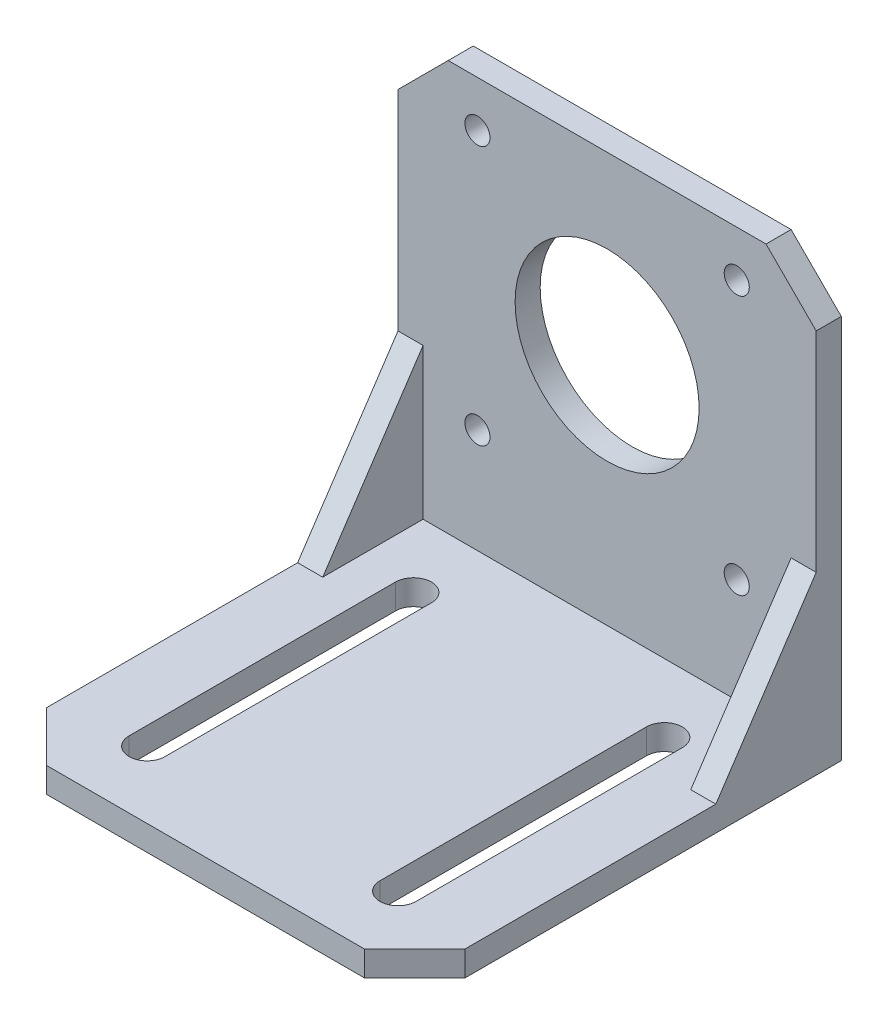
from build123d import *

# Parameters (mm, degrees)
SKETCH1_R           = 11
SKETCH1_R_2         = 1.5
BOSS_EXTRUDE1_DEPTH = 3
SKETCH2_W           = 50
SKETCH2_H           = 3
BOSS_EXTRUDE2_DEPTH = 48
CUT_EXTRUDE1_REACH  = 79.006
BOSS_EXTRUDE3_START = 22
BOSS_EXTRUDE3_DEPTH = 3
LPATTERN2_COUNT     = 2
LPATTERN2_PITCH     = 47
CUT_EXTRUDE2_REACH  = 66.707
CUT_EXTRUDE3_REACH  = 79.006


with BuildPart() as part:
    # Sketch1 → Boss-Extrude1 (new body)
    with BuildSketch(Plane.XY):
        Polygon((-25, 21), (25, 21), (25, -21), (25, -31), (-25, -31), (-25, -21), align=None)
        Circle(SKETCH1_R, mode=Mode.SUBTRACT)
        with Locations((-15.5, 15.5)):
            Circle(SKETCH1_R_2, mode=Mode.SUBTRACT)
        with Locations((15.5, 15.5)):
            Circle(SKETCH1_R_2, mode=Mode.SUBTRACT)
        with Locations((-15.5, -15.5)):
            Circle(SKETCH1_R_2, mode=Mode.SUBTRACT)
        with Locations((15.5, -15.5)):
            Circle(SKETCH1_R_2, mode=Mode.SUBTRACT)
    extrude(amount=BOSS_EXTRUDE1_DEPTH)

    # Sketch2 → Boss-Extrude2 (add)
    with BuildSketch(Plane.XY.offset(3)):
        with Locations((0, -29.5)):
            Rectangle(SKETCH2_W, SKETCH2_H)
    extrude(amount=BOSS_EXTRUDE2_DEPTH)

    # Sketch3 → Cut-Extrude1 (cut, up to next)
    with BuildSketch(Plane.XZ.offset(31), mode=Mode.PRIVATE) as cut_extrude1_sk1:
        with BuildLine():
            Line((-12.85, 43), (-12.85, 11.15))
            ThreePointArc((-12.85, 11.15), (-15, 9), (-17.15, 11.15))
            Line((-17.15, 11.15), (-17.15, 43))
            ThreePointArc((-17.15, 43), (-15, 45.15), (-12.85, 43))
        make_face()
    cut_extrude1_tool1 = extrude(cut_extrude1_sk1.sketch, amount=-CUT_EXTRUDE1_REACH, mode=Mode.PRIVATE) & part.part
    # Sketch3 → Cut-Extrude1 (cut, up to next)
    with BuildSketch(Plane.XZ.offset(31), mode=Mode.PRIVATE) as cut_extrude1_sk2:
        with BuildLine():
            Line((12.85, 43), (12.85, 11.15))
            ThreePointArc((12.85, 11.15), (15, 9), (17.15, 11.15))
            Line((17.15, 11.15), (17.15, 43))
            ThreePointArc((17.15, 43), (15, 45.15), (12.85, 43))
        make_face()
    cut_extrude1_tool2 = extrude(cut_extrude1_sk2.sketch, amount=-CUT_EXTRUDE1_REACH, mode=Mode.PRIVATE) & part.part
    add(cut_extrude1_tool1.solids().sort_by_distance((-15, -31, 27.075))[0], mode=Mode.SUBTRACT)
    add(cut_extrude1_tool2.solids().sort_by_distance((15, -31, 27.075))[0], mode=Mode.SUBTRACT)

    # Sketch4 → Boss-Extrude3 (add)
    with BuildSketch(Plane(origin=(0, 0, 0), x_dir=(0, 0, -1), z_dir=(1, 0, 0)).offset(BOSS_EXTRUDE3_START)):
        Polygon((-3, -28), (-3, -10), (-15, -28), align=None)
    boss_extrude3 = extrude(amount=BOSS_EXTRUDE3_DEPTH)

    # LPattern2: Boss-Extrude3 ×2
    with Locations(*[(-i * LPATTERN2_PITCH, 0, 0) for i in range(1, LPATTERN2_COUNT)]):
        add(boss_extrude3)

    # Sketch5 → Cut-Extrude2 (cut, up to next)
    with BuildSketch(Plane(origin=(0, 0, 0), x_dir=(-1, 0, 0), z_dir=(0, 0, -1)), mode=Mode.PRIVATE) as cut_extrude2_sk1:
        Polygon((-19, 21), (-25, 15), (-25, 21), align=None)
    cut_extrude2_tool1 = extrude(cut_extrude2_sk1.sketch, amount=-CUT_EXTRUDE2_REACH, mode=Mode.PRIVATE) & part.part
    # Sketch5 → Cut-Extrude2 (cut, up to next)
    with BuildSketch(Plane(origin=(0, 0, 0), x_dir=(-1, 0, 0), z_dir=(0, 0, -1)), mode=Mode.PRIVATE) as cut_extrude2_sk2:
        Polygon((25, 21), (19, 21), (25, 15), align=None)
    cut_extrude2_tool2 = extrude(cut_extrude2_sk2.sketch, amount=-CUT_EXTRUDE2_REACH, mode=Mode.PRIVATE) & part.part
    add(cut_extrude2_tool1.solids().sort_by_distance((23, 19, 0))[0], mode=Mode.SUBTRACT)
    add(cut_extrude2_tool2.solids().sort_by_distance((-23, 19, 0))[0], mode=Mode.SUBTRACT)

    # Sketch6 → Cut-Extrude3 (cut, up to next)
    with BuildSketch(Plane.XZ.offset(31), mode=Mode.PRIVATE) as cut_extrude3_sk1:
        Polygon((-25, 51), (-25, 45), (-19, 51), align=None)
    cut_extrude3_tool1 = extrude(cut_extrude3_sk1.sketch, amount=-CUT_EXTRUDE3_REACH, mode=Mode.PRIVATE) & part.part
    # Sketch6 → Cut-Extrude3 (cut, up to next)
    with BuildSketch(Plane.XZ.offset(31), mode=Mode.PRIVATE) as cut_extrude3_sk2:
        Polygon((25, 51), (19, 51), (25, 45), align=None)
    cut_extrude3_tool2 = extrude(cut_extrude3_sk2.sketch, amount=-CUT_EXTRUDE3_REACH, mode=Mode.PRIVATE) & part.part
    add(cut_extrude3_tool1.solids().sort_by_distance((-23, -31, 49))[0], mode=Mode.SUBTRACT)
    add(cut_extrude3_tool2.solids().sort_by_distance((23, -31, 49))[0], mode=Mode.SUBTRACT)


solid = part.part
